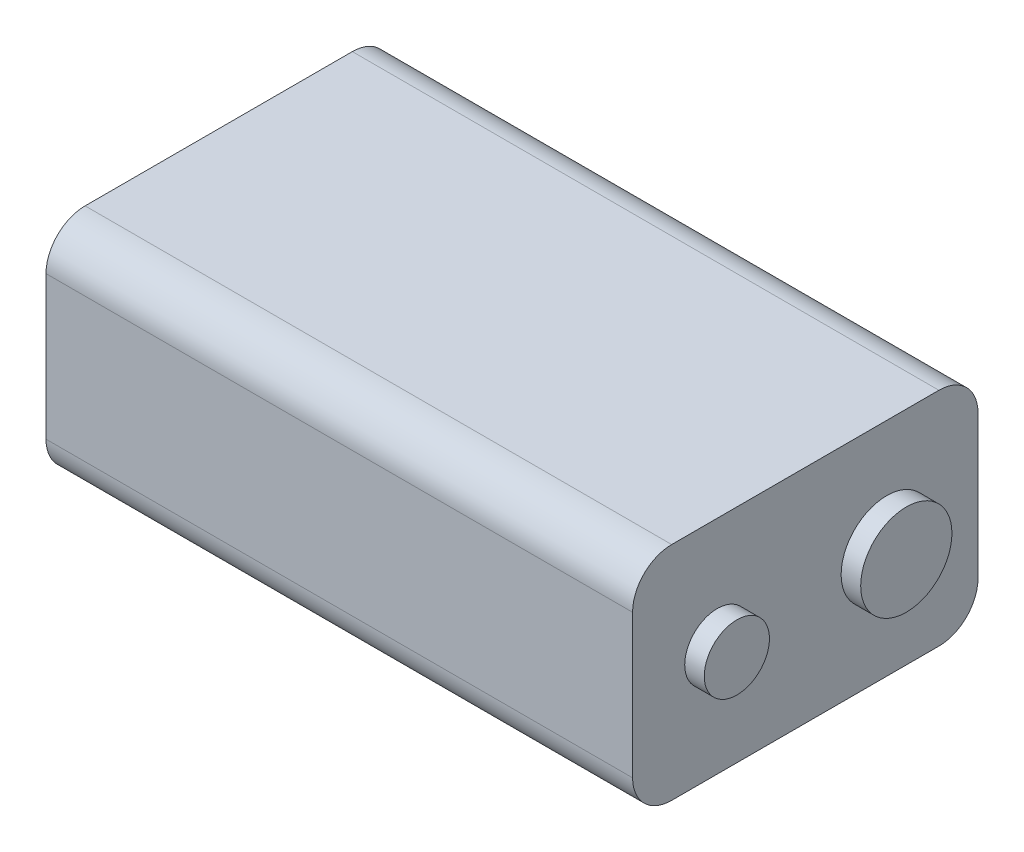
from build123d import *

# Parameters (mm, degrees)
SKETCH1_W           = 45
SKETCH1_H           = 26.5
BOSS_EXTRUDE1_DEPTH = 17
FILLET1_R           = 3
SKETCH2_R           = 3.5
SKETCH2_R_2         = 2.5
BOSS_EXTRUDE2_DEPTH = 1.5


with BuildPart() as part:
    # Sketch1 → Boss-Extrude1 (new body)
    with BuildSketch(Plane(origin=(0, 0, 0), x_dir=(1, 0, 0), z_dir=(0, 1, 0))):
        with Locations((0.552556883, 5.047981579)):
            Rectangle(SKETCH1_W, SKETCH1_H)
    extrude(amount=BOSS_EXTRUDE1_DEPTH)

    # Fillet1
    fillet1_edges = [part.edges().sort_by_distance(p)[0] for p in [
        (0.552556883, 17, -18.297981579),
        (0.552556883, 0, -18.297981579),
        (0.552556883, 0, 8.202018421),
        (0.552556883, 17, 8.202018421),
    ]]
    fillet(fillet1_edges, radius=FILLET1_R)

    # Sketch2 → Boss-Extrude2 (add)
    with BuildSketch(Plane(origin=(23.052556883, 0, 0), x_dir=(0, 0, -1), z_dir=(1, 0, 0))):
        with Locations(Location((11.297981579, 8.5, 0), (0, 0, 180))):
            Circle(SKETCH2_R)
        with Locations(Location((-1.702018421, 8.5, 0), (0, 0, 180))):
            Circle(SKETCH2_R_2)
    extrude(amount=BOSS_EXTRUDE2_DEPTH)


solid = part.part
